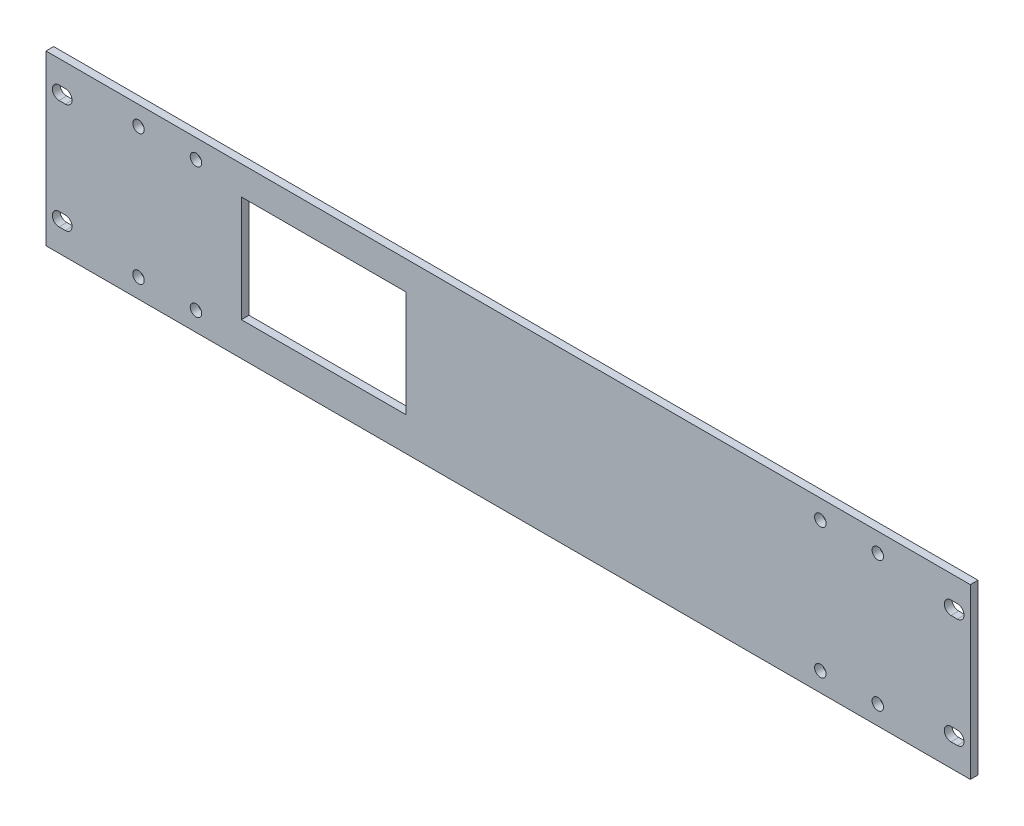
from build123d import *

# Parameters (mm, degrees)
SKETCH_1_W          = 482.6
SKETCH_1_H          = 88.1
EXTRUDE_1_DEPTH     = 4
CUT_EXTRUDE_1_DEPTH = 491.591856842
SKETCH_3_R          = 3
CUT_EXTRUDE_2_DEPTH = 491.591856842
SKETCH_4_W          = 86
SKETCH_4_H          = 55.5
CUT_EXTRUDE_3_DEPTH = 491.591856842


with BuildPart() as part:
    # Эскиз1 → Бобышка-Вытянуть1 (new body)
    with BuildSketch(Plane.XY):
        with Locations((241.3, 44.05)):
            Rectangle(SKETCH_1_W, SKETCH_1_H)
    extrude(amount=EXTRUDE_1_DEPTH)

    # Эскиз2 → Вырез-Вытянуть1 (cut, through all)
    with BuildSketch(Plane.XY.offset(4)):
        with BuildLine():
            Line((6.8, 76.12), (10.1, 76.12))
            ThreePointArc((10.1, 76.12), (13.6, 72.62), (10.1, 69.12))
            Line((10.1, 69.12), (6.8, 69.12))
            ThreePointArc((6.8, 69.12), (3.3, 72.62), (6.8, 76.12))
        make_face()
        with BuildLine():
            Line((472.5, 76.12), (475.8, 76.12))
            ThreePointArc((475.8, 76.12), (479.3, 72.62), (475.8, 69.12))
            Line((475.8, 69.12), (472.5, 69.12))
            ThreePointArc((472.5, 69.12), (469, 72.62), (472.5, 76.12))
        make_face()
        with BuildLine():
            Line((472.5, 18.97), (475.8, 18.97))
            ThreePointArc((475.8, 18.97), (479.3, 15.47), (475.8, 11.97))
            Line((475.8, 11.97), (472.5, 11.97))
            ThreePointArc((472.5, 11.97), (469, 15.47), (472.5, 18.97))
        make_face()
        with BuildLine():
            Line((6.8, 18.97), (10.1, 18.97))
            ThreePointArc((10.1, 18.97), (13.6, 15.47), (10.1, 11.97))
            Line((10.1, 11.97), (6.8, 11.97))
            ThreePointArc((6.8, 11.97), (3.3, 15.47), (6.8, 18.97))
        make_face()
    extrude(amount=-CUT_EXTRUDE_1_DEPTH, mode=Mode.SUBTRACT)

    # Эскиз3 → Вырез-Вытянуть2 (cut, through all)
    with BuildSketch(Plane.XY.offset(4)):
        with Locations((78.3, 78.1)):
            Circle(SKETCH_3_R)
        with Locations((404.3, 78.1)):
            Circle(SKETCH_3_R)
        with Locations((404.3, 10)):
            Circle(SKETCH_3_R)
        with Locations((78.3, 10)):
            Circle(SKETCH_3_R)
        with Locations((48.3, 78.1)):
            Circle(SKETCH_3_R)
        with Locations((434.3, 78.1)):
            Circle(SKETCH_3_R)
        with Locations((434.3, 10)):
            Circle(SKETCH_3_R)
        with Locations((48.3, 10)):
            Circle(SKETCH_3_R)
    extrude(amount=-CUT_EXTRUDE_2_DEPTH, mode=Mode.SUBTRACT)

    # Эскиз4 → Вырез-Вытянуть3 (cut, through all)
    with BuildSketch(Plane.XY.offset(4)):
        with Locations((145, 45.35)):
            Rectangle(SKETCH_4_W, SKETCH_4_H)
    extrude(amount=-CUT_EXTRUDE_3_DEPTH, mode=Mode.SUBTRACT)


solid = part.part
